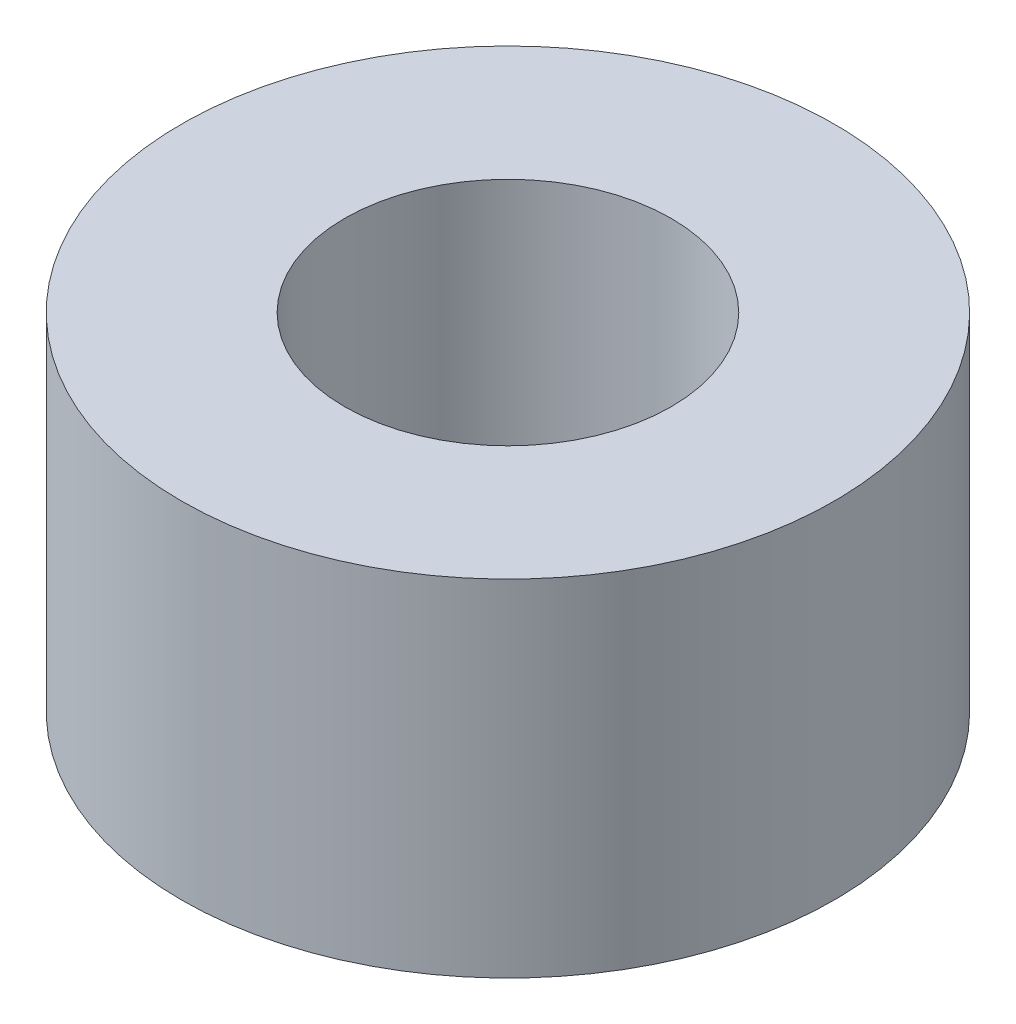
from build123d import *

# Parameters (mm, degrees)
SKETCH1_R           = 6
SKETCH1_R_2         = 3
BOSS_EXTRUDE1_DEPTH = 3.175


with BuildPart() as part:
    # Sketch1 → Boss-Extrude1 (new, symmetric)
    with BuildSketch(Plane(origin=(0, 0, 0), x_dir=(1, 0, 0), z_dir=(0, 1, 0))):
        with Locations(Location((0, 0, 0), (0, 0, 270))):
            Circle(SKETCH1_R)
        with Locations(Location((0, 0, 0), (0, 0, 270))):
            Circle(SKETCH1_R_2, mode=Mode.SUBTRACT)
    extrude(amount=BOSS_EXTRUDE1_DEPTH, both=True)


solid = part.part
